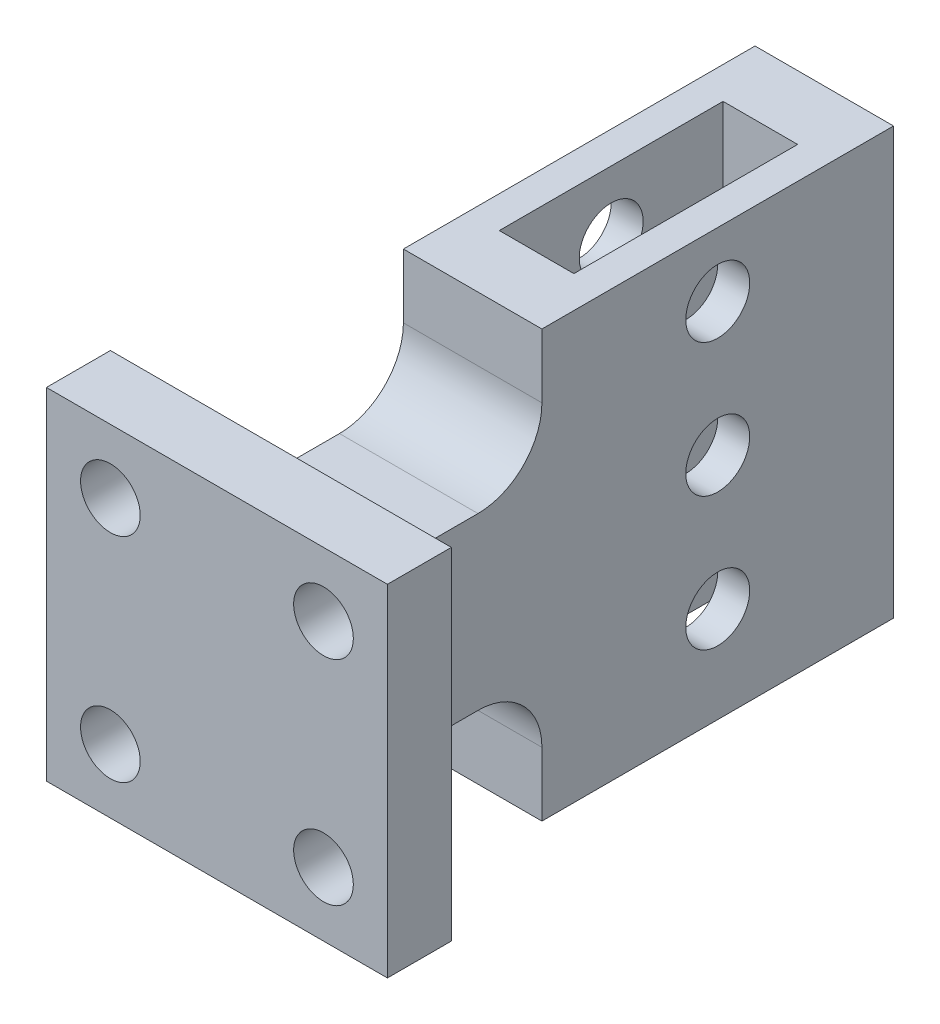
from build123d import *

# Parameters (mm, degrees)
SKETCH1_W           = 6.5
SKETCH1_H           = 25.5
SKETCH1_W_2         = 3.5
SKETCH1_H_2         = 10.5
BOSS_EXTRUDE1_DEPTH = 10
SKETCH2_W           = 16
SKETCH2_H           = 3
BOSS_EXTRUDE2_DEPTH = 8
CUT_EXTRUDE1_REACH  = 23.786
CUT_EXTRUDE2_REACH  = 33.245
SKETCH4_R           = 1.4
FILLET1_R           = 3
SKETCH6_R           = 1.5
CUT_EXTRUDE4_DEPTH  = 22.785889929


with BuildPart() as part:
    # Sketch1 → Boss-Extrude1 (new, symmetric)
    with BuildSketch(Plane(origin=(0, 0, 0), x_dir=(1, 0, 0), z_dir=(0, 1, 0))):
        Rectangle(SKETCH1_W, SKETCH1_H)
        with Locations((0, 4.5)):
            Rectangle(SKETCH1_W_2, SKETCH1_H_2, mode=Mode.SUBTRACT)
    extrude(amount=BOSS_EXTRUDE1_DEPTH, both=True)

    # Sketch2 → Boss-Extrude2 (add, symmetric)
    with BuildSketch(Plane.XZ):
        with Locations((0, 14.25)):
            Rectangle(SKETCH2_W, SKETCH2_H)
    extrude(amount=BOSS_EXTRUDE2_DEPTH, both=True)

    # Sketch3 → Cut-Extrude1 (cut, up to next)
    with BuildSketch(Plane.ZY.offset(3.25), mode=Mode.PRIVATE) as cut_extrude1_sk1:
        Polygon((12.75, -4), (3.75, -4), (3.75, -10), (12.75, -10), (12.75, -8), align=None)
    cut_extrude1_tool1 = extrude(cut_extrude1_sk1.sketch, amount=-CUT_EXTRUDE1_REACH, mode=Mode.PRIVATE) & part.part
    # Sketch3 → Cut-Extrude1 (cut, up to next)
    with BuildSketch(Plane.ZY.offset(3.25), mode=Mode.PRIVATE) as cut_extrude1_sk2:
        Polygon((12.75, 8), (12.75, 10), (3.75, 10), (3.75, 4), (12.75, 4), align=None)
    cut_extrude1_tool2 = extrude(cut_extrude1_sk2.sketch, amount=-CUT_EXTRUDE1_REACH, mode=Mode.PRIVATE) & part.part
    add(cut_extrude1_tool1.solids().sort_by_distance((-3.25, -7, 8.25))[0], mode=Mode.SUBTRACT)
    add(cut_extrude1_tool2.solids().sort_by_distance((-3.25, 7, 8.25))[0], mode=Mode.SUBTRACT)

    # Sketch4 → Cut-Extrude2 (cut, up to next)
    with BuildSketch(Plane.XY.offset(15.75), mode=Mode.PRIVATE) as cut_extrude2_sk1:
        with Locations((5, -5)):
            Circle(SKETCH4_R)
    cut_extrude2_tool1 = extrude(cut_extrude2_sk1.sketch, amount=-CUT_EXTRUDE2_REACH, mode=Mode.PRIVATE) & part.part
    # Sketch4 → Cut-Extrude2 (cut, up to next)
    with BuildSketch(Plane.XY.offset(15.75), mode=Mode.PRIVATE) as cut_extrude2_sk2:
        with Locations((5, 5)):
            Circle(SKETCH4_R)
    cut_extrude2_tool2 = extrude(cut_extrude2_sk2.sketch, amount=-CUT_EXTRUDE2_REACH, mode=Mode.PRIVATE) & part.part
    # Sketch4 → Cut-Extrude2 (cut, up to next)
    with BuildSketch(Plane.XY.offset(15.75), mode=Mode.PRIVATE) as cut_extrude2_sk3:
        with Locations((-5, 5)):
            Circle(SKETCH4_R)
    cut_extrude2_tool3 = extrude(cut_extrude2_sk3.sketch, amount=-CUT_EXTRUDE2_REACH, mode=Mode.PRIVATE) & part.part
    # Sketch4 → Cut-Extrude2 (cut, up to next)
    with BuildSketch(Plane.XY.offset(15.75), mode=Mode.PRIVATE) as cut_extrude2_sk4:
        with Locations((-5, -5)):
            Circle(SKETCH4_R)
    cut_extrude2_tool4 = extrude(cut_extrude2_sk4.sketch, amount=-CUT_EXTRUDE2_REACH, mode=Mode.PRIVATE) & part.part
    add(cut_extrude2_tool1.solids().sort_by_distance((5, -5, 15.75))[0], mode=Mode.SUBTRACT)
    add(cut_extrude2_tool2.solids().sort_by_distance((5, 5, 15.75))[0], mode=Mode.SUBTRACT)
    add(cut_extrude2_tool3.solids().sort_by_distance((-5, 5, 15.75))[0], mode=Mode.SUBTRACT)
    add(cut_extrude2_tool4.solids().sort_by_distance((-5, -5, 15.75))[0], mode=Mode.SUBTRACT)

    # Fillet1
    fillet1_edges = [part.edges().sort_by_distance(p)[0] for p in [
        (0, -4, 3.75),
        (0, 4, 3.75),
    ]]
    fillet(fillet1_edges, radius=FILLET1_R)

    # Sketch6 → Cut-Extrude4 (cut, through all)
    with BuildSketch(Plane(origin=(3.25, 0, 0), x_dir=(0, 0, -1), z_dir=(1, 0, 0))):
        with Locations((4.5, 7)):
            Circle(SKETCH6_R)
        with Locations((4.5, -5.5)):
            Circle(SKETCH6_R)
        with Locations((4.5, 0.75)):
            Circle(SKETCH6_R)
    extrude(amount=-CUT_EXTRUDE4_DEPTH, mode=Mode.SUBTRACT)


solid = part.part
